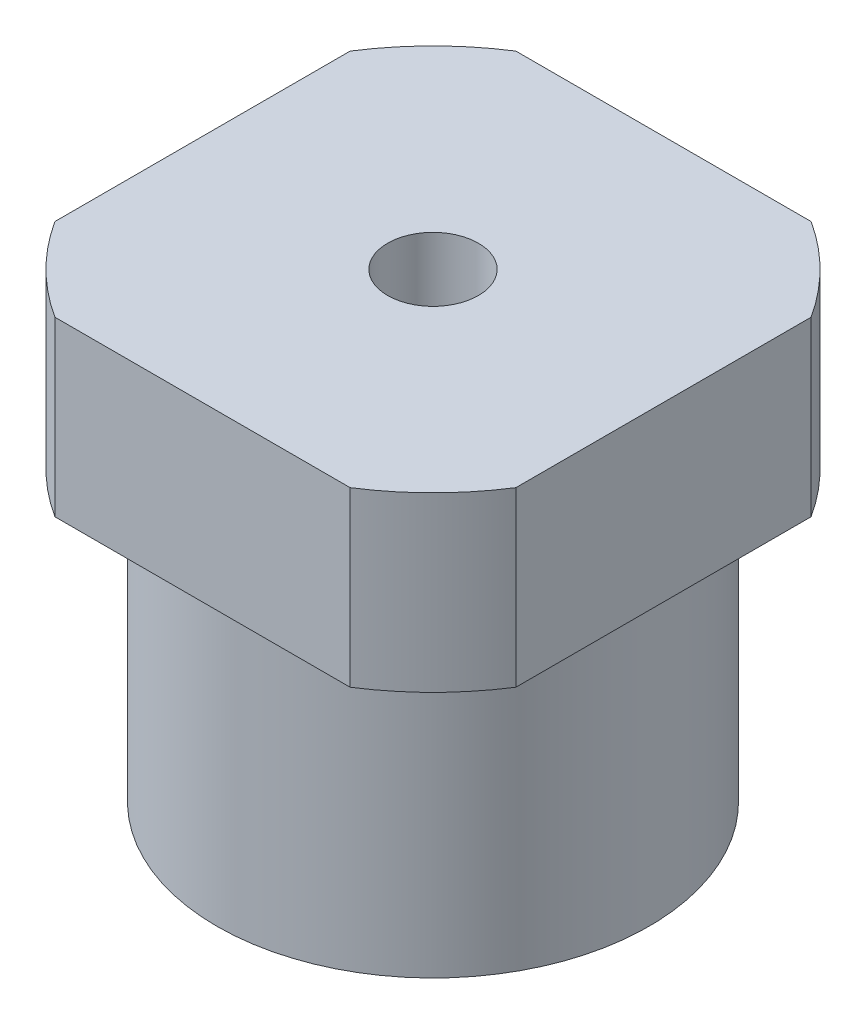
from build123d import *

# Parameters (mm, degrees)
SKETCH1_R           = 9.525
BOSS_EXTRUDE1_DEPTH = 12.7
SKETCH2_W           = 20.32
SKETCH2_H           = 20.32
BOSS_EXTRUDE2_DEPTH = 7.62
CUT_EXTRUDE2_DEPTH  = 25.886815787
SKETCH5_R           = 2.000000064
CUT_EXTRUDE3_DEPTH  = 25.886815787


with BuildPart() as part:
    # Sketch1 → Boss-Extrude1 (new body)
    with BuildSketch(Plane(origin=(0, 0, 0), x_dir=(1, 0, 0), z_dir=(0, 1, 0))):
        Circle(SKETCH1_R)
    extrude(amount=BOSS_EXTRUDE1_DEPTH)

    # Sketch2 → Boss-Extrude2 (add)
    with BuildSketch(Plane(origin=(0, 12.7, 0), x_dir=(1, 0, 0), z_dir=(0, 1, 0))):
        Rectangle(SKETCH2_W, SKETCH2_H)
    extrude(amount=BOSS_EXTRUDE2_DEPTH)

    # Sketch3 → Cut-Extrude2 (cut, through all)
    with BuildSketch(Plane(origin=(0, 20.32, 0), x_dir=(1, 0, 0), z_dir=(0, 1, 0))):
        with BuildLine():
            Line((-6.506813736, 10.16), (-10.16, 10.16))
            Line((-10.16, 10.16), (-10.16, 6.506813736))
            ThreePointArc((-10.16, 6.506813736), (-8.531243315, 8.531243315), (-6.506813736, 10.16))
        make_face()
        with BuildLine():
            Line((10.16, 10.16), (6.506813736, 10.16))
            ThreePointArc((6.506813736, 10.16), (8.531243315, 8.531243315), (10.16, 6.506813736))
            Line((10.16, 6.506813736), (10.16, 10.16))
        make_face()
        with BuildLine():
            ThreePointArc((-6.506813736, -10.16), (-8.531243315, -8.531243315), (-10.16, -6.506813736))
            Line((-10.16, -6.506813736), (-10.16, -10.16))
            Line((-10.16, -10.16), (-6.506813736, -10.16))
        make_face()
        with BuildLine():
            Line((10.16, -10.16), (10.16, -6.506813736))
            ThreePointArc((10.16, -6.506813736), (8.531243315, -8.531243315), (6.506813736, -10.16))
            Line((6.506813736, -10.16), (10.16, -10.16))
        make_face()
    extrude(amount=-CUT_EXTRUDE2_DEPTH, mode=Mode.SUBTRACT)

    # Sketch5 → Cut-Extrude3 (cut, through all)
    with BuildSketch(Plane(origin=(0, 20.32, 0), x_dir=(1, 0, 0), z_dir=(0, 1, 0))):
        Circle(SKETCH5_R)
    extrude(amount=-CUT_EXTRUDE3_DEPTH, mode=Mode.SUBTRACT)


solid = part.part
